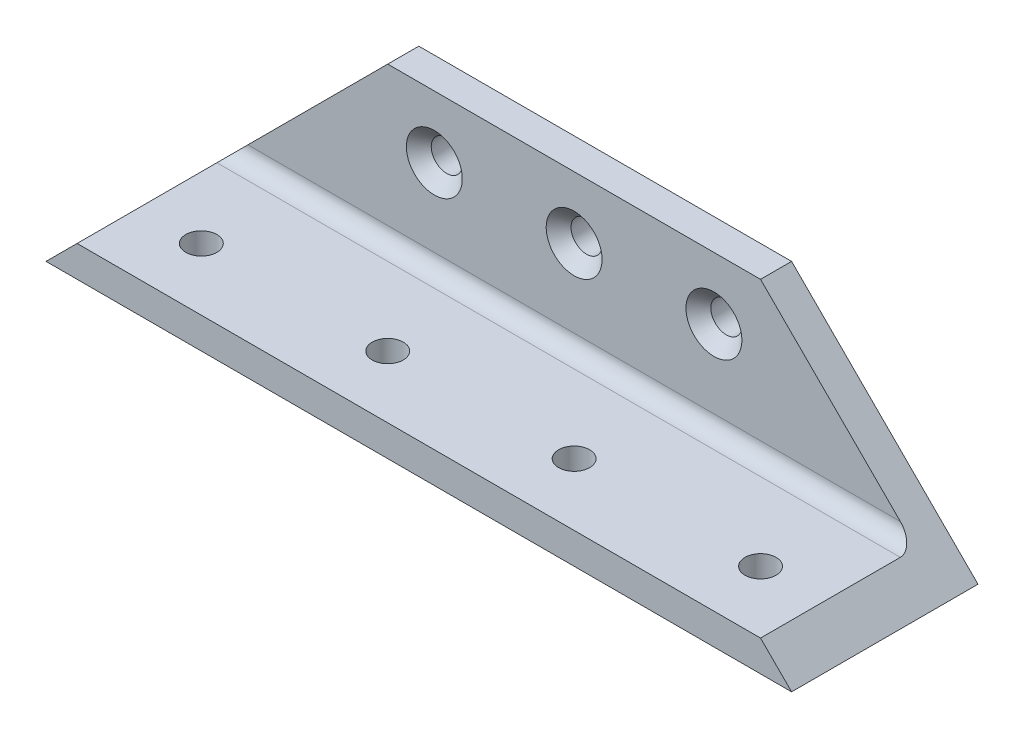
from build123d import *

# Parameters (mm, degrees)
BOSS_EXTRUDE1_DEPTH = 152.4
FILLET1_R           = 3.175
SKETCH2_R           = 3.175
CUT_EXTRUDE2_DEPTH  = 152.4
CHAMFER1_SIZE       = 2.54
CHAMFER2_SIZE       = 2.54
SKETCH3_R           = 3.175
CUT_EXTRUDE3_DEPTH  = 152.4
CUT_EXTRUDE4_DEPTH  = 152.4


with BuildPart() as part:
    # Sketch1 → Boss-Extrude1 (new body)
    with BuildSketch(Plane(origin=(0, 0, 0), x_dir=(0, 0, -1), z_dir=(1, 0, 0))):
        Polygon((19.05, -19.05), (-19.05, -19.05), (-19.05, -12.7), (12.7, -12.7), (12.7, 19.05), (19.05, 19.05), align=None)
    extrude(amount=BOSS_EXTRUDE1_DEPTH)

    # Fillet1
    fillet1_edges = [part.edges().sort_by_distance(p)[0] for p in [
        (76.2, -12.7, -12.7),
    ]]
    fillet(fillet1_edges, radius=FILLET1_R)

    # Sketch2 → Cut-Extrude2 (cut)
    with BuildSketch(Plane(origin=(0, 0, -19.05), x_dir=(-1, 0, 0), z_dir=(0, 0, -1))):
        with Locations((-104.775, 6.35)):
            Circle(SKETCH2_R)
        with Locations((-76.2, 6.35)):
            Circle(SKETCH2_R)
        with Locations((-47.625, 6.35)):
            Circle(SKETCH2_R)
    extrude(amount=-CUT_EXTRUDE2_DEPTH, mode=Mode.SUBTRACT)

    # Chamfer1
    chamfer1_edges = [part.edges().sort_by_distance(p)[0] for p in [
        (50.8, 6.35, -12.7),
    ]]
    chamfer(chamfer1_edges, length=CHAMFER1_SIZE)

    # Chamfer2
    chamfer2_edges = [part.edges().sort_by_distance(p)[0] for p in [
        (107.95, 6.35, -12.7),
        (79.375, 6.35, -12.7),
    ]]
    chamfer(chamfer2_edges, length=CHAMFER2_SIZE)

    # Sketch3 → Cut-Extrude3 (cut)
    with BuildSketch(Plane(origin=(0, -12.7, 0), x_dir=(1, 0, 0), z_dir=(0, 1, 0))):
        with Locations(Location((19.05, -6.35, 0), (0, 0, 270))):
            Circle(SKETCH3_R)
        with Locations(Location((57.15, -6.35, 0), (0, 0, 270))):
            Circle(SKETCH3_R)
        with Locations(Location((95.25, -6.35, 0), (0, 0, 270))):
            Circle(SKETCH3_R)
        with Locations(Location((133.35, -6.35, 0), (0, 0, 270))):
            Circle(SKETCH3_R)
    extrude(amount=-CUT_EXTRUDE3_DEPTH, mode=Mode.SUBTRACT)

    # Sketch4 → Cut-Extrude4 (cut)
    with BuildSketch(Plane(origin=(0, 0, -19.05), x_dir=(-1, 0, 0), z_dir=(0, 0, -1))):
        Polygon((-152.4, -19.05), (-114.3, 19.05), (-152.4, 19.05), align=None)
        Polygon((0, -19.05), (-38.1, 19.05), (0, 19.05), align=None)
    extrude(amount=-CUT_EXTRUDE4_DEPTH, mode=Mode.SUBTRACT)


solid = part.part
